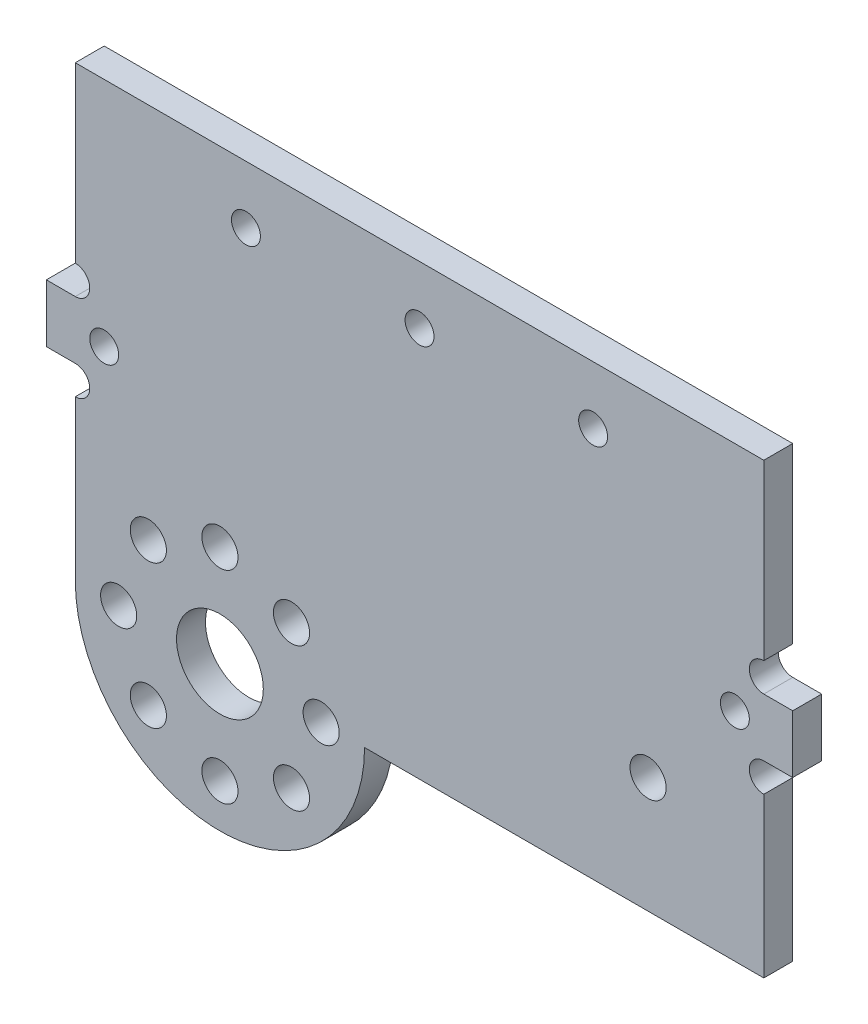
from build123d import *

# Parameters (mm, degrees)
SKETCH_1_R      = 3
SKETCH_1_R_2    = 1.25
SKETCH_1_R_3    = 1
EXTRUDE_2_DEPTH = 2


with BuildPart() as part:
    # 草圖1 → 填料-伸長2 (new body)
    with BuildSketch(Plane.XY):
        with BuildLine():
            Line((-7.587453917, -13.1179941), (18.058094933, -13.1179941))
            Line((18.058094933, -13.1179941), (19.058094933, -13.1179941))
            Line((19.058094933, -13.1179941), (19.058094933, -12.1179941))
            Line((19.058094933, -12.1179941), (19.058094933, -2.1179941))
            ThreePointArc((19.058094933, -2.1179941), (18.058094933, -1.1179941), (19.058094933, -0.1179941))
            Line((19.058094933, -0.1179941), (21.058094933, -0.1179941))
            Line((21.058094933, -0.1179941), (21.058094933, 3.8820059))
            Line((21.058094933, 3.8820059), (19.058094933, 3.8820059))
            ThreePointArc((19.058094933, 3.8820059), (18.058094933, 4.8820059), (19.058094933, 5.8820059))
            Line((19.058094933, 5.8820059), (19.058094933, 9.8820059))
            Line((19.058094933, 9.8820059), (19.058094933, 10.8820059))
            Line((19.058094933, 10.8820059), (19.058094933, 16.8820059))
            Line((19.058094933, 16.8820059), (19.058094933, 17.8820059))
            Line((19.058094933, 17.8820059), (18.058094933, 17.8820059))
            Line((18.058094933, 17.8820059), (-27.541905067, 17.8820059))
            Line((-27.541905067, 17.8820059), (-28.541905067, 17.8820059))
            Line((-28.541905067, 17.8820059), (-28.541905067, 16.8820059))
            Line((-28.541905067, 16.8820059), (-28.541905067, 10.8820059))
            Line((-28.541905067, 10.8820059), (-28.541905067, 9.8820059))
            Line((-28.541905067, 9.8820059), (-28.541905067, 5.8820059))
            ThreePointArc((-28.541905067, 5.8820059), (-27.541905067, 4.8820059), (-28.541905067, 3.8820059))
            Line((-28.541905067, 3.8820059), (-30.541905067, 3.8820059))
            Line((-30.541905067, 3.8820059), (-30.541905067, -0.1179941))
            Line((-30.541905067, -0.1179941), (-28.541905067, -0.1179941))
            ThreePointArc((-28.541905067, -0.1179941), (-27.541905067, -1.1179941), (-28.541905067, -2.1179941))
            Line((-28.541905067, -2.1179941), (-28.541905067, -13.1179941))
            ThreePointArc((-28.541905067, -13.1179941), (-18.541905067, -23.1179941), (-8.541905067, -13.1179941))
            Line((-8.541905067, -13.1179941), (-7.587453917, -13.1179941))
        make_face()
        with Locations((-18.541905067, -13.1179941)):
            Circle(SKETCH_1_R, mode=Mode.SUBTRACT)
        with Locations((-18.541905067, -6.1179941)):
            Circle(SKETCH_1_R_2, mode=Mode.SUBTRACT)
        with Locations((-13.592157599, -8.168246632)):
            Circle(SKETCH_1_R_2, mode=Mode.SUBTRACT)
        with Locations((-11.541905067, -13.1179941)):
            Circle(SKETCH_1_R_2, mode=Mode.SUBTRACT)
        with Locations((-13.592157599, -18.067741569)):
            Circle(SKETCH_1_R_2, mode=Mode.SUBTRACT)
        with Locations((-18.541905067, -20.1179941)):
            Circle(SKETCH_1_R_2, mode=Mode.SUBTRACT)
        with Locations((-23.491652536, -18.067741569)):
            Circle(SKETCH_1_R_2, mode=Mode.SUBTRACT)
        with Locations((-25.541905067, -13.1179941)):
            Circle(SKETCH_1_R_2, mode=Mode.SUBTRACT)
        with Locations((-23.491652536, -8.168246632)):
            Circle(SKETCH_1_R_2, mode=Mode.SUBTRACT)
        with Locations((-26.541905067, 1.8820059)):
            Circle(SKETCH_1_R_3, mode=Mode.SUBTRACT)
        with Locations((17.058094933, 1.8820059)):
            Circle(SKETCH_1_R_3, mode=Mode.SUBTRACT)
        with Locations((-4.741905067, 13.8820059)):
            Circle(SKETCH_1_R_3, mode=Mode.SUBTRACT)
        with Locations((11.058094933, -5.1179941)):
            Circle(SKETCH_1_R_2, mode=Mode.SUBTRACT)
        with Locations((-16.741905067, 13.8820059)):
            Circle(SKETCH_1_R_3, mode=Mode.SUBTRACT)
        with Locations((7.258094933, 13.8820059)):
            Circle(SKETCH_1_R_3, mode=Mode.SUBTRACT)
    extrude(amount=EXTRUDE_2_DEPTH)


solid = part.part
